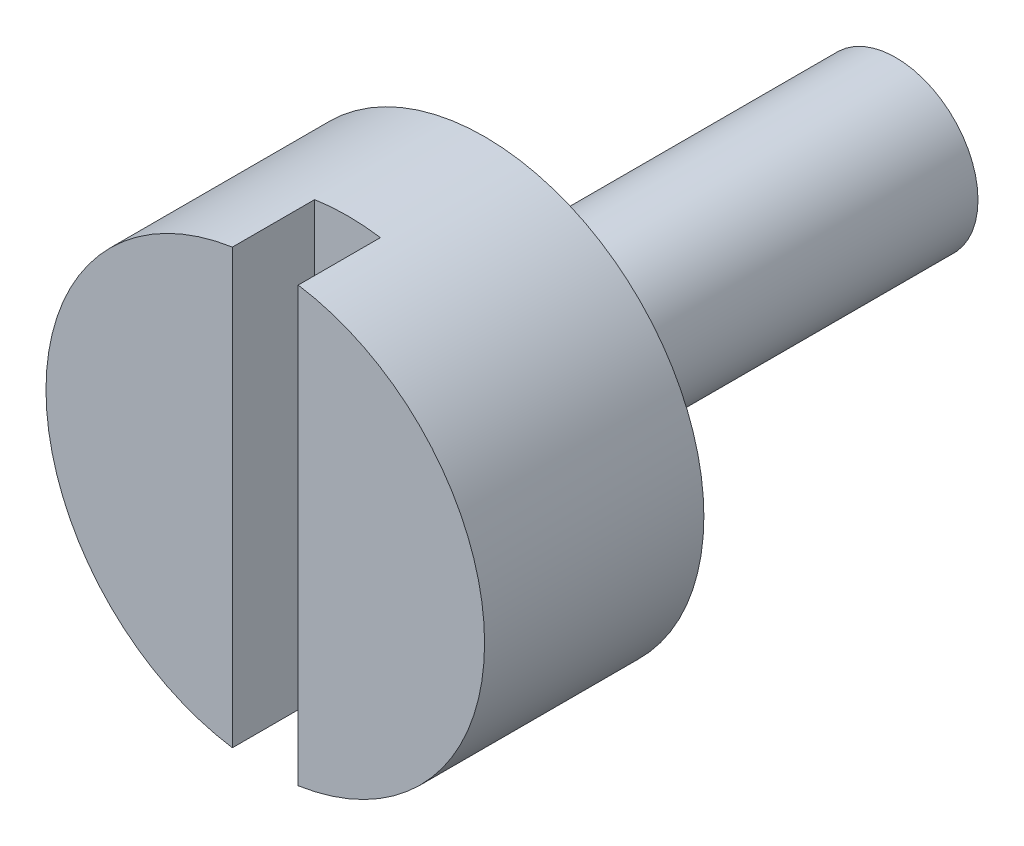
from build123d import *

# Parameters (mm, degrees)
M3_THREAD_ENVELOPE_SELECT_HARDWARE_START = 40
SKETCH1_R                                = 1.5
M3_THREAD_ENVELOPE_SELECT_HARDWARE_DEPTH = 7.5
THUMB_HEAD_START                         = 47.5
SKETCH2_R                                = 4
THUMB_HEAD_DEPTH                         = 4
DRIVER_SLOT_START                        = 50
SKETCH3_W                                = 1.2
SKETCH3_H                                = 10
DRIVER_SLOT_DEPTH                        = 3


with BuildPart() as part:
    # Sketch1 → M3_thread_envelope_select_hardware (new body)
    with BuildSketch(Plane.XY.offset(M3_THREAD_ENVELOPE_SELECT_HARDWARE_START)):
        with Locations((-20, 0)):
            Circle(SKETCH1_R)
    extrude(amount=M3_THREAD_ENVELOPE_SELECT_HARDWARE_DEPTH)

    # Sketch2 → Thumb_head (add)
    with BuildSketch(Plane.XY.offset(THUMB_HEAD_START)):
        with Locations((-20, 0)):
            Circle(SKETCH2_R)
    extrude(amount=THUMB_HEAD_DEPTH)

    # Sketch3 → Driver_slot (cut)
    with BuildSketch(Plane.XY.offset(DRIVER_SLOT_START)):
        with Locations((-20, 0)):
            Rectangle(SKETCH3_W, SKETCH3_H)
    extrude(amount=DRIVER_SLOT_DEPTH, mode=Mode.SUBTRACT)


solid = part.part
